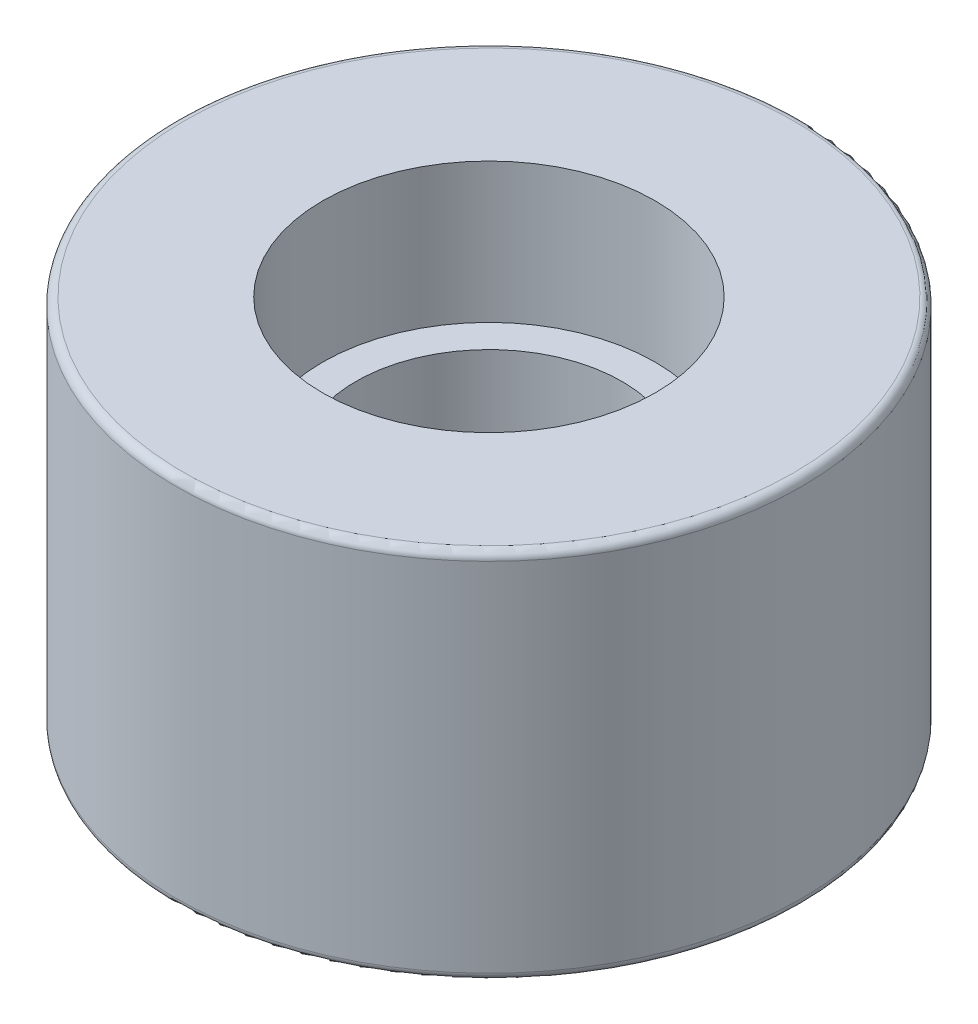
from build123d import *


with BuildPart() as part:
    # Szkic1 → Obrót1 (revolve)
    with BuildSketch(Plane.XY, mode=Mode.PRIVATE) as obr_t1_sk:
        with BuildLine():
            Line((-12.5, 28), (-22.9, 28))
            ThreePointArc((-22.9, 28), (-23.324264069, 27.824264069), (-23.5, 27.4))
            Line((-23.5, 27.4), (-23.5, 0.6))
            ThreePointArc((-23.5, 0.6), (-23.324264069, 0.175735931), (-22.9, 0))
            Line((-22.9, 0), (-13.5, 0))
            Line((-13.5, 0), (-13.5, 10.5))
            Line((-13.5, 10.5), (-10, 10.5))
            Line((-10, 10.5), (-10, 17.5))
            Line((-10, 17.5), (-12.5, 17.5))
            Line((-12.5, 17.5), (-12.5, 28))
        make_face()
    revolve(obr_t1_sk.sketch.rotate(Axis((0, 0, 0), (0, 1, 0)), 180), axis=Axis((0, 0, 0), (0, 1, 0)))


solid = part.part
